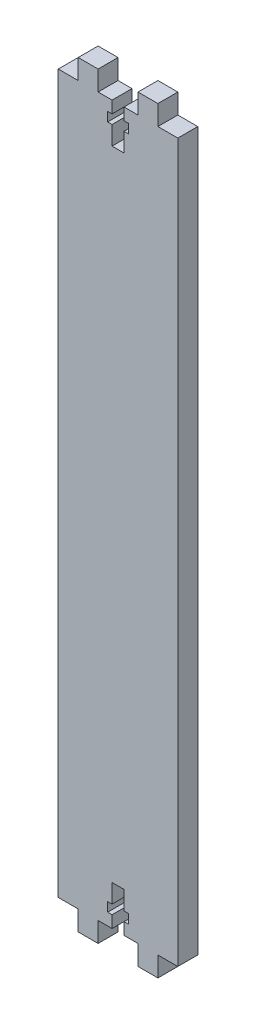
from build123d import *

# Parameters (mm, degrees)
BOSS_EXTRU_1_DEPTH = 5


with BuildPart() as part:
    # Esquisse1 → Boss.-Extru.1 (new body)
    with BuildSketch(Plane.XY):
        Polygon((-15, 185), (-15, 95), (15, 95), (15, 185), (10, 185), (10, 190), (5, 190), (5, 185), (1.5, 185), (1.5, 182), (2.6, 182), (2.6, 179.7), (1.5, 179.7), (1.5, 175), (-1.5, 175), (-1.5, 179.7), (-2.6, 179.7), (-2.6, 182), (-1.5, 182), (-1.5, 185), (-5, 185), (-5, 190), (-10, 190), (-10, 185), align=None)
        Polygon((-15, 5), (-10, 5), (-10, 0), (-5, 0), (-5, 5), (-1.5, 5), (-1.5, 8), (-2.6, 8), (-2.6, 10.3), (-1.5, 10.3), (-1.5, 15), (1.5, 15), (1.5, 10.3), (2.6, 10.3), (2.6, 8), (1.5, 8), (1.5, 5), (5, 5), (5, 0), (10, 0), (10, 5), (15, 5), (15, 95), (-15, 95), align=None)
    extrude(amount=BOSS_EXTRU_1_DEPTH)


solid = part.part
